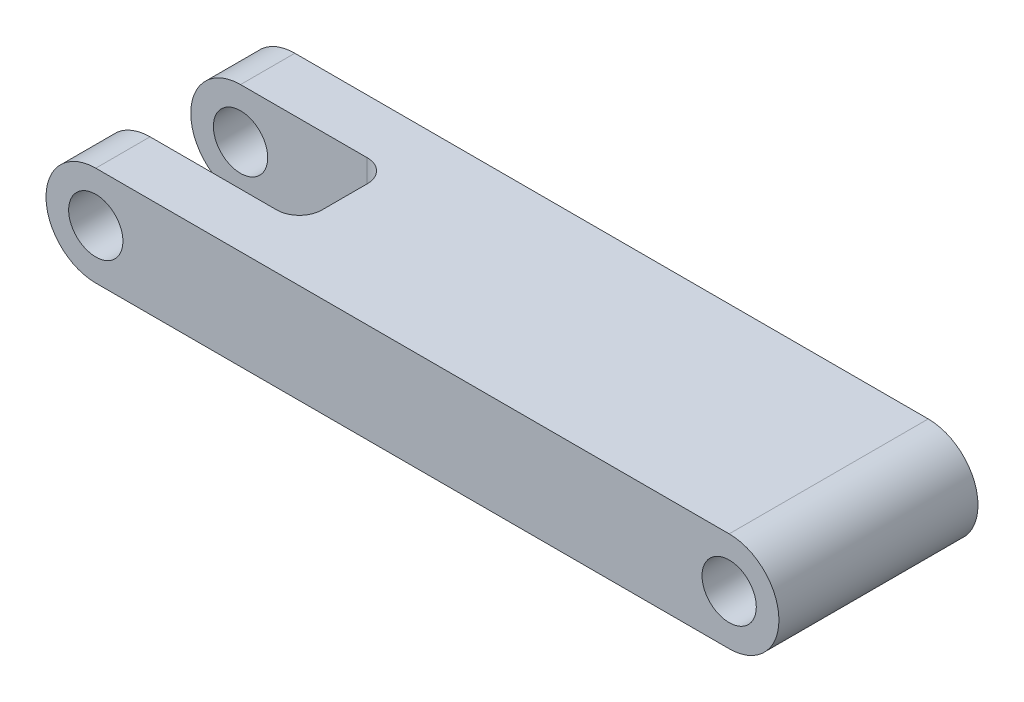
from build123d import *

# Parameters (mm, degrees)
SKETCH1_R           = 6
BOSS_EXTRUDE1_DEPTH = 44
SKETCH2_W           = 88
SKETCH2_H           = 20
CUT_EXTRUDE1_DEPTH  = 159.811208672
FILLET1_R           = 5


with BuildPart() as part:
    # Sketch1 → Boss-Extrude1 (new body)
    with BuildSketch(Plane.XY):
        with BuildLine():
            Line((0, 11), (140, 11))
            ThreePointArc((140, 11), (151, 0), (140, -11))
            Line((140, -11), (0, -11))
            ThreePointArc((0, -11), (-11, 0), (0, 11))
        make_face()
        Circle(SKETCH1_R, mode=Mode.SUBTRACT)
        with Locations((140, 0)):
            Circle(SKETCH1_R, mode=Mode.SUBTRACT)
    extrude(amount=BOSS_EXTRUDE1_DEPTH)

    # Sketch2 → Cut-Extrude1 (cut, through all)
    with BuildSketch(Plane(origin=(0, 11, 0), x_dir=(1, 0, 0), z_dir=(0, 1, 0))):
        with Locations((-11, -22)):
            Rectangle(SKETCH2_W, SKETCH2_H)
    extrude(amount=-CUT_EXTRUDE1_DEPTH, mode=Mode.SUBTRACT)

    # Fillet1
    fillet1_edges = [part.edges().sort_by_distance(p)[0] for p in [
        (33, 0, 32),
        (33, 0, 12),
    ]]
    fillet(fillet1_edges, radius=FILLET1_R)


solid = part.part
